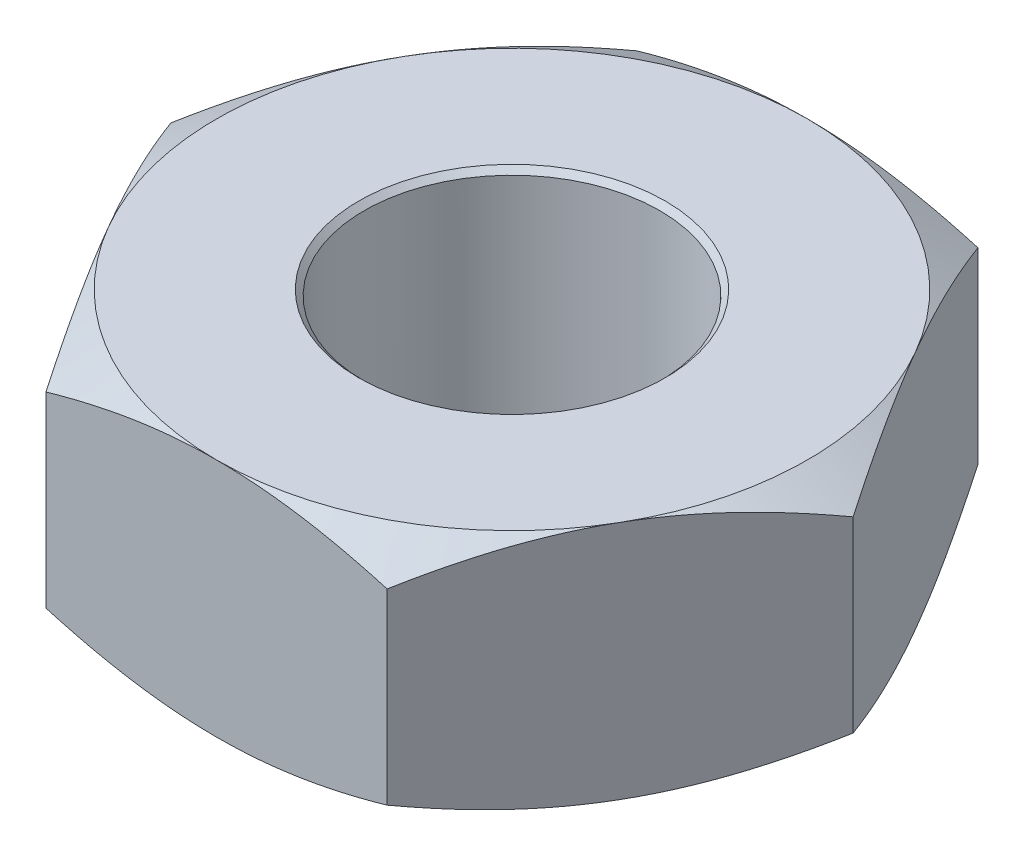
from build123d import *

# Parameters (mm, degrees)
SKETCH2_R           = 2
BOSS_EXTRUDE1_DEPTH = 3.25
SKETCH3_OUTSIDE_W   = 25.026
SKETCH3_OUTSIDE_H   = 23.788
SKETCH3_OUTSIDE_R   = 4
CUT_EXTRUDE1_DEPTH  = 3.25
CUT_EXTRUDE1_DRAFT  = 60
SKETCH4_OUTSIDE_W   = 25.026
SKETCH4_OUTSIDE_H   = 23.788
SKETCH4_OUTSIDE_R   = 4
CUT_EXTRUDE2_DEPTH  = 3.25
CUT_EXTRUDE2_DRAFT  = -60
CHAMFER1_SIZE       = 0.075


with BuildPart() as part:
    # Sketch2 → Boss-Extrude1 (new body)
    with BuildSketch(Plane(origin=(0, 0, 0), x_dir=(1, 0, 0), z_dir=(0, 1, 0))):
        Polygon((4.618802154, 0), (2.309401077, 4), (-2.309401077, 4), (-4.618802154, 0), (-2.309401077, -4), (2.309401077, -4), align=None)
        with Locations(Location((0, 0, 0), (0, 0, 90))):
            Circle(SKETCH2_R, mode=Mode.SUBTRACT)
    extrude(amount=BOSS_EXTRUDE1_DEPTH)


with BuildPart() as cut_extrude1_tool:
    # Sketch3 outside → Cut-Extrude1 (with draft: the straight prism first)
    with BuildSketch(Plane(origin=(0, 0, 0), x_dir=(1, 0, 0), z_dir=(0, 1, 0))):
        Rectangle(SKETCH3_OUTSIDE_W, SKETCH3_OUTSIDE_H)
        Circle(SKETCH3_OUTSIDE_R, mode=Mode.SUBTRACT)
    extrude(amount=CUT_EXTRUDE1_DEPTH)
    # Cut-Extrude1: the draft: its side faces are tilted about the plane it starts from
    cut_extrude1_sides = [cut_extrude1_tool.faces().sort_by_distance(p)[0] for p in [
        (0, 1.625, 11.894),
        (12.513, 1.625, 0),
        (0, 1.625, -11.894),
        (-12.513, 1.625, 0),
        (-4, 1.625, 0),
    ]]
    draft(cut_extrude1_sides, Plane(origin=(0, 0, 0), x_dir=(1, 0, 0), z_dir=(0, 1, 0)), CUT_EXTRUDE1_DRAFT)


with BuildPart() as part_1:
    add(part.part)

    # Cut-Extrude1: cut by cut_extrude1_tool
    add(cut_extrude1_tool.part, mode=Mode.SUBTRACT)


with BuildPart() as cut_extrude2_tool:
    # Sketch4 outside → Cut-Extrude2 (with draft: the straight prism first)
    with BuildSketch(Plane(origin=(0, 3.25, 0), x_dir=(1, 0, 0), z_dir=(0, 1, 0))):
        Rectangle(SKETCH4_OUTSIDE_W, SKETCH4_OUTSIDE_H)
        Circle(SKETCH4_OUTSIDE_R, mode=Mode.SUBTRACT)
    extrude(amount=-CUT_EXTRUDE2_DEPTH)
    # Cut-Extrude2: the draft: its side faces are tilted about the plane it starts from
    cut_extrude2_sides = [cut_extrude2_tool.faces().sort_by_distance(p)[0] for p in [
        (0, 1.625, 11.894),
        (12.513, 1.625, 0),
        (0, 1.625, -11.894),
        (-12.513, 1.625, 0),
        (-4, 1.625, 0),
    ]]
    draft(cut_extrude2_sides, Plane(origin=(0, 3.25, 0), x_dir=(1, 0, 0), z_dir=(0, 1, 0)), CUT_EXTRUDE2_DRAFT)


with BuildPart() as part_2:
    add(part_1.part)

    # Cut-Extrude2: cut by cut_extrude2_tool
    add(cut_extrude2_tool.part, mode=Mode.SUBTRACT)

    # Chamfer1
    chamfer1_edges = [part_2.edges().sort_by_distance(p)[0] for p in [
        (0, 0, 2),
        (0, 3.25, 2),
    ]]
    chamfer(chamfer1_edges, length=CHAMFER1_SIZE)


solid = part_2.part
